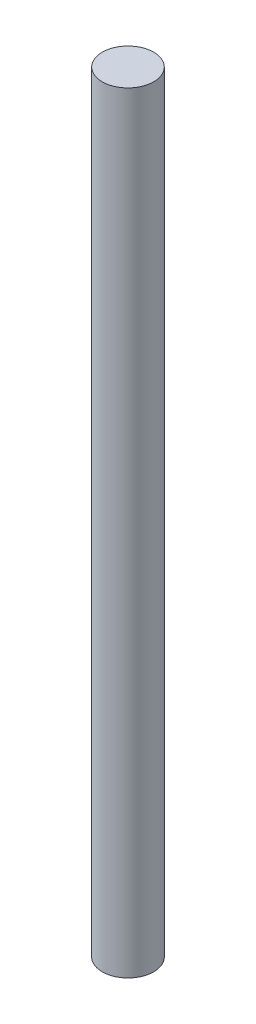
from build123d import *

# Parameters (mm, degrees)
SKETCH_1_R      = 4
EXTRUDE_1_DEPTH = 120


with BuildPart() as part:
    # 草图1 → 凸台-拉伸1 (new body)
    with BuildSketch(Plane(origin=(0, 0, 0), x_dir=(1, 0, 0), z_dir=(0, 1, 0))):
        with Locations(Location((0, 0, 0), (0, 0, 270))):
            Circle(SKETCH_1_R)
    extrude(amount=EXTRUDE_1_DEPTH)


solid = part.part
